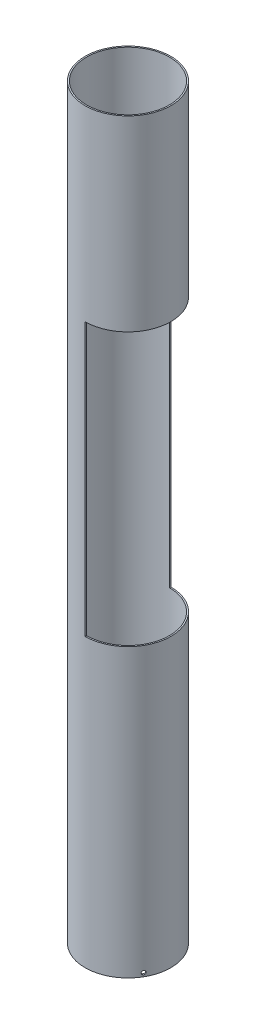
from build123d import *

# Parameters (mm, degrees)
SKETCH1_R           = 39.37
SKETCH1_R_2         = 38.1
BOSS_EXTRUDE1_DEPTH = 685.8
SKETCH2_R           = 1.692869147
CUT_EXTRUDE1_DEPTH  = 61.4
CIRPATTERN3_COUNT   = 3
CUT_EXTRUDE2_DEPTH  = 72.4


with BuildPart() as part:
    # Sketch1 → Boss-Extrude1 (new body)
    with BuildSketch(Plane(origin=(0, 0, 0), x_dir=(1, 0, 0), z_dir=(0, 1, 0))):
        with Locations(Location((0, 0, 0), (0, 0, 270))):
            Circle(SKETCH1_R)
        with Locations(Location((0, 0, 0), (0, 0, 270))):
            Circle(SKETCH1_R_2, mode=Mode.SUBTRACT)
    extrude(amount=BOSS_EXTRUDE1_DEPTH)

    # Sketch2 → Cut-Extrude1 (cut)
    with BuildSketch(Plane.XY):
        with Locations(Location((0, 3.287142885, 0), (0, 0, 90))):
            Circle(SKETCH2_R)
    cut_extrude1 = extrude(amount=-CUT_EXTRUDE1_DEPTH, mode=Mode.SUBTRACT)

    # CirPattern3: Cut-Extrude1 ×3 about axis
    cirpattern3_axis = Axis((0, 0, 0), (0, -1, 0))
    for i in range(1, CIRPATTERN3_COUNT):
        add(cut_extrude1.rotate(cirpattern3_axis, i * 360 / CIRPATTERN3_COUNT), mode=Mode.SUBTRACT)

    # Sketch3 → Cut-Extrude2 (cut)
    with BuildSketch(Plane(origin=(0, 0, 0), x_dir=(0, 0, -1), z_dir=(1, 0, 0))):
        Polygon((-39.37, 513.990392655), (39.37, 513.990392655), (39.37, 282.655028446), (39.37, 269.955028446), (39.37, 263.605028446), (-39.37, 263.605028446), (-39.37, 269.955028446), (-39.37, 276.305028446), (-39.37, 282.655028446), align=None)
    extrude(amount=CUT_EXTRUDE2_DEPTH, mode=Mode.SUBTRACT)


solid = part.part
